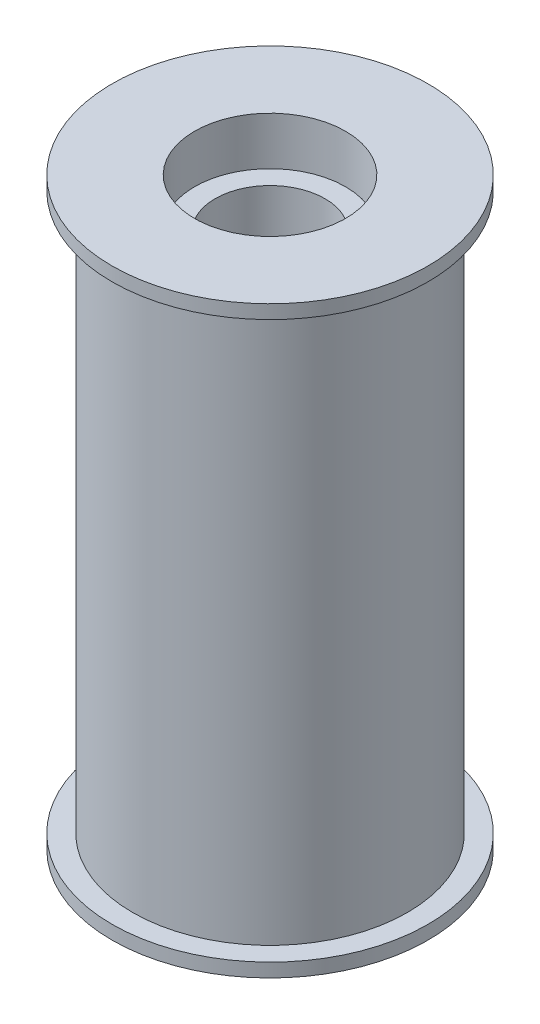
from build123d import *

# Parameters (mm, degrees)
ESQUISSE1_R             = 20
BOSS_EXTRU_1_DEPTH      = 85
ESQUISSE6_R             = 8
ENL_V_MAT_EXTRU_1_DEPTH = 85
ESQUISSE7_R             = 11
ENL_V_MAT_EXTRU_2_DEPTH = 7
ESQUISSE11_W            = 3
ESQUISSE11_H            = 2


with BuildPart() as part:
    # Esquisse1 → Boss.-Extru.1 (new body)
    with BuildSketch(Plane(origin=(0, 0, 0), x_dir=(1, 0, 0), z_dir=(0, 1, 0))):
        with Locations(Location((0, 0, 0), (0, 0, 270))):
            Circle(ESQUISSE1_R)
    extrude(amount=BOSS_EXTRU_1_DEPTH)

    # Esquisse6 → Enlèv. mat.-Extru.1 (cut)
    with BuildSketch(Plane.XZ):
        with Locations(Location((0, 0, 0), (0, 0, 270))):
            Circle(ESQUISSE6_R)
    extrude(amount=-ENL_V_MAT_EXTRU_1_DEPTH, mode=Mode.SUBTRACT)

    # Esquisse7 → Enlèv. mat.-Extru.2 (cut)
    with BuildSketch(Plane.XZ):
        with Locations(Location((0, 0, 0), (0, 0, 270))):
            Circle(ESQUISSE7_R)
    enl_v_mat_extru_2 = extrude(amount=-ENL_V_MAT_EXTRU_2_DEPTH, mode=Mode.SUBTRACT)

    # Symétrie1: Enlèv. mat.-Extru.2 across plane
    add(enl_v_mat_extru_2.mirror(Plane.ZX.offset(42.5)), mode=Mode.SUBTRACT)

    # Esquisse11 → Révolution1 (revolve)
    with BuildSketch(Plane(origin=(0, 0, 0), x_dir=(0, 0, -1), z_dir=(1, 0, 0))):
        with Locations((21.485433731, 1)):
            Rectangle(ESQUISSE11_W, ESQUISSE11_H)
    r_volution1 = revolve(axis=Axis((0, 85, 0), (0, -1, 0)))

    # Symétrie2: Révolution1 across plane
    add(r_volution1.mirror(Plane.ZX.offset(42.5)))


solid = part.part
